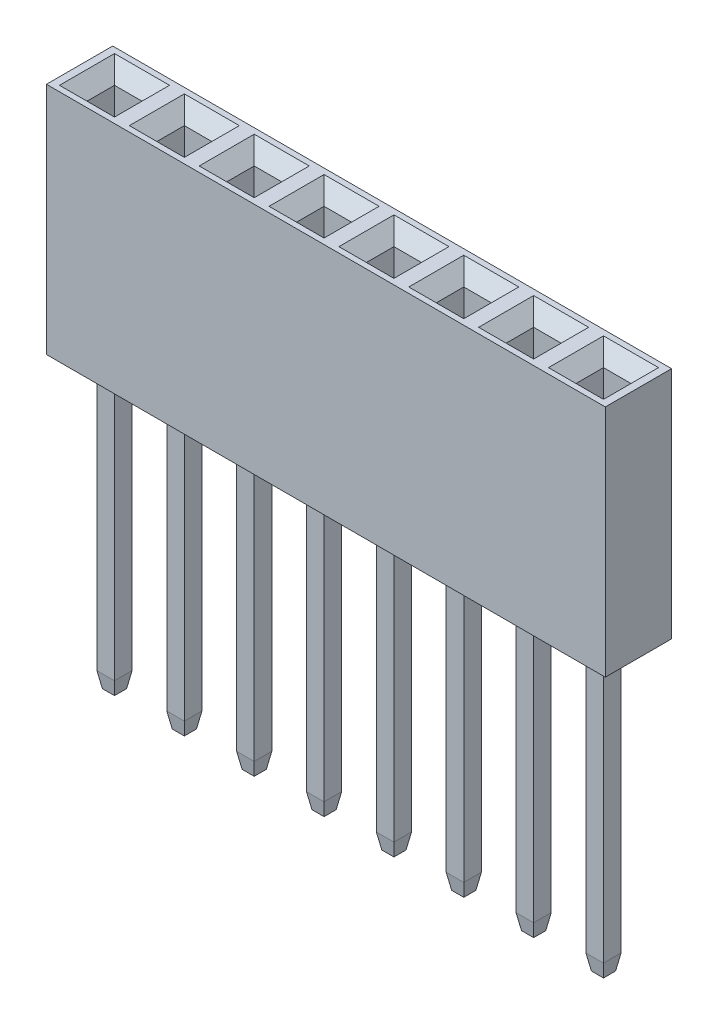
from build123d import *

# Parameters (mm, degrees)
SKETCH2_W                  = 20.32
SKETCH2_H                  = 2.41
BOSS_EXTRUDE1_DEPTH        = 8.51
SKETCH5_W                  = 1
SKETCH5_H                  = 1
CUT_EXTRUDE1_DEPTH         = 5
CHAMFER1_SIZE              = 0.5
LPATTERN3_COUNT            = 8
LPATTERN3_PITCH            = 2.54
CHAMFER1_OF_LPATTERN3_SIZE = 0.5
SKETCH11_W                 = 0.64
SKETCH11_H                 = 0.64
BOSS_EXTRUDE2_DEPTH        = 9.92
LPATTERN4_COUNT            = 8
LPATTERN4_PITCH            = 2.54


with BuildPart() as part:
    # Sketch2 → Boss-Extrude1 (new body)
    with BuildSketch(Plane(origin=(0, 0, 0), x_dir=(1, 0, 0), z_dir=(0, 1, 0))):
        with Locations((8.89, 0)):
            Rectangle(SKETCH2_W, SKETCH2_H)
    extrude(amount=BOSS_EXTRUDE1_DEPTH)

    # Sketch5 → Cut-Extrude1 (cut)
    with BuildSketch(Plane(origin=(0, 8.51, 0), x_dir=(1, 0, 0), z_dir=(0, 1, 0))):
        Rectangle(SKETCH5_W, SKETCH5_H)
    cut_extrude1 = extrude(amount=-CUT_EXTRUDE1_DEPTH, mode=Mode.SUBTRACT)

    # Chamfer1
    chamfer1_edges = [part.edges().sort_by_distance(p)[0] for p in [
        (-0.5, 8.51, 0),
        (0, 8.51, 0.5),
        (0.5, 8.51, 0),
        (0, 8.51, -0.5),
    ]]
    chamfer(chamfer1_edges, length=CHAMFER1_SIZE)

    # LPattern3: Cut-Extrude1 ×8
    with Locations(*[(i * LPATTERN3_PITCH, 0, 0) for i in range(1, LPATTERN3_COUNT)]):
        add(cut_extrude1, mode=Mode.SUBTRACT)

    # Chamfer1 of LPattern3
    chamfer1_of_lpattern3_edges = [part.edges().sort_by_distance(p)[0] for p in [
        (2.04, 8.51, 0),
        (2.54, 8.51, 0.5),
        (3.04, 8.51, 0),
        (2.54, 8.51, -0.5),
        (4.58, 8.51, 0),
        (5.08, 8.51, 0.5),
        (5.58, 8.51, 0),
        (5.08, 8.51, -0.5),
        (7.12, 8.51, 0),
        (7.62, 8.51, 0.5),
        (8.12, 8.51, 0),
        (7.62, 8.51, -0.5),
        (9.66, 8.51, 0),
        (10.16, 8.51, 0.5),
        (10.66, 8.51, 0),
        (10.16, 8.51, -0.5),
        (12.2, 8.51, 0),
        (12.7, 8.51, 0.5),
        (13.2, 8.51, 0),
        (12.7, 8.51, -0.5),
        (14.74, 8.51, 0),
        (15.24, 8.51, 0.5),
        (15.74, 8.51, 0),
        (15.24, 8.51, -0.5),
        (17.28, 8.51, 0),
        (17.78, 8.51, 0.5),
        (18.28, 8.51, 0),
        (17.78, 8.51, -0.5),
    ]]
    chamfer(chamfer1_of_lpattern3_edges, length=CHAMFER1_OF_LPATTERN3_SIZE)

    # Sketch11 → Boss-Extrude2 (add)
    with BuildSketch(Plane.XZ):
        Rectangle(SKETCH11_W, SKETCH11_H)
    boss_extrude2 = extrude(amount=BOSS_EXTRUDE2_DEPTH)

    # Sketch13 → Loft1 section 0
    with BuildSketch(Plane.XZ.offset(9.92)):
        with BuildLine():
            Line((0.32, -0.32), (0.32, 0.32))
            Line((0.32, 0.32), (-0.32, 0.32))
            Line((-0.32, 0.32), (-0.32, -0.32))
            Line((-0.32, -0.32), (0.32, -0.32))
        make_face()
    # Sketch14 → Loft1 section 1
    with BuildSketch(Plane(origin=(0, -10.49, 0), x_dir=(-1, 0, 0), z_dir=(0, -1, 0))):
        with BuildLine():
            Line((-0.22, 0.22), (0.22, 0.22))
            Line((0.22, 0.22), (0.22, -0.22))
            Line((0.22, -0.22), (-0.22, -0.22))
            Line((-0.22, -0.22), (-0.22, 0.22))
        make_face()
    loft1 = loft()

    # LPattern4: Boss-Extrude2, Loft1 ×8
    with Locations(*[(i * LPATTERN4_PITCH, 0, 0) for i in range(1, LPATTERN4_COUNT)]):
        add(boss_extrude2)
        add(loft1)


solid = part.part
